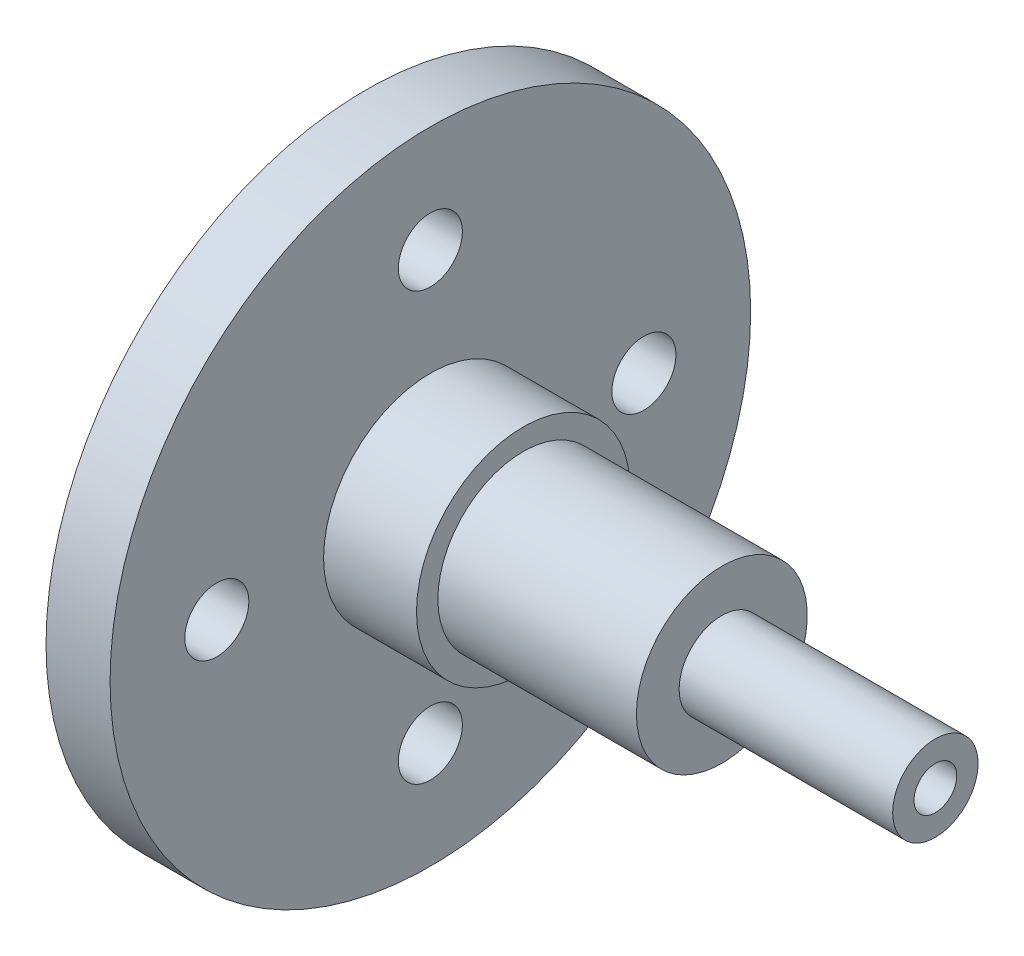
from build123d import *

# Parameters (mm, degrees)
SKETCH2_R          = 1.5
CUT_EXTRUDE1_DEPTH = 32.769836323


with BuildPart() as part:
    # Sketch1 → Revolve1 (revolve)
    with BuildSketch(Plane.XY, mode=Mode.PRIVATE) as revolve1_sk:
        Polygon((-13.325, 1), (-13.325, 15), (-10.325, 15), (-10.325, 5), (-5.975, 5), (-5.975, 4), (3.325, 4), (3.325, 2), (13.325, 2), (13.325, 1), align=None)
    revolve(revolve1_sk.sketch.rotate(Axis((-13.325, 0, 0), (1, 0, 0)), 90), axis=Axis((-13.325, 0, 0), (1, 0, 0)))

    # Sketch2 → Cut-Extrude1 (cut, through all)
    with BuildSketch(Plane(origin=(-10.325, 0, 0), x_dir=(0, 0, -1), z_dir=(1, 0, 0))):
        with Locations((0, 10)):
            Circle(SKETCH2_R)
        with Locations((10, 0)):
            Circle(SKETCH2_R)
        with Locations((0, -10)):
            Circle(SKETCH2_R)
        with Locations((-10, 0)):
            Circle(SKETCH2_R)
    extrude(amount=-CUT_EXTRUDE1_DEPTH, mode=Mode.SUBTRACT)


solid = part.part
